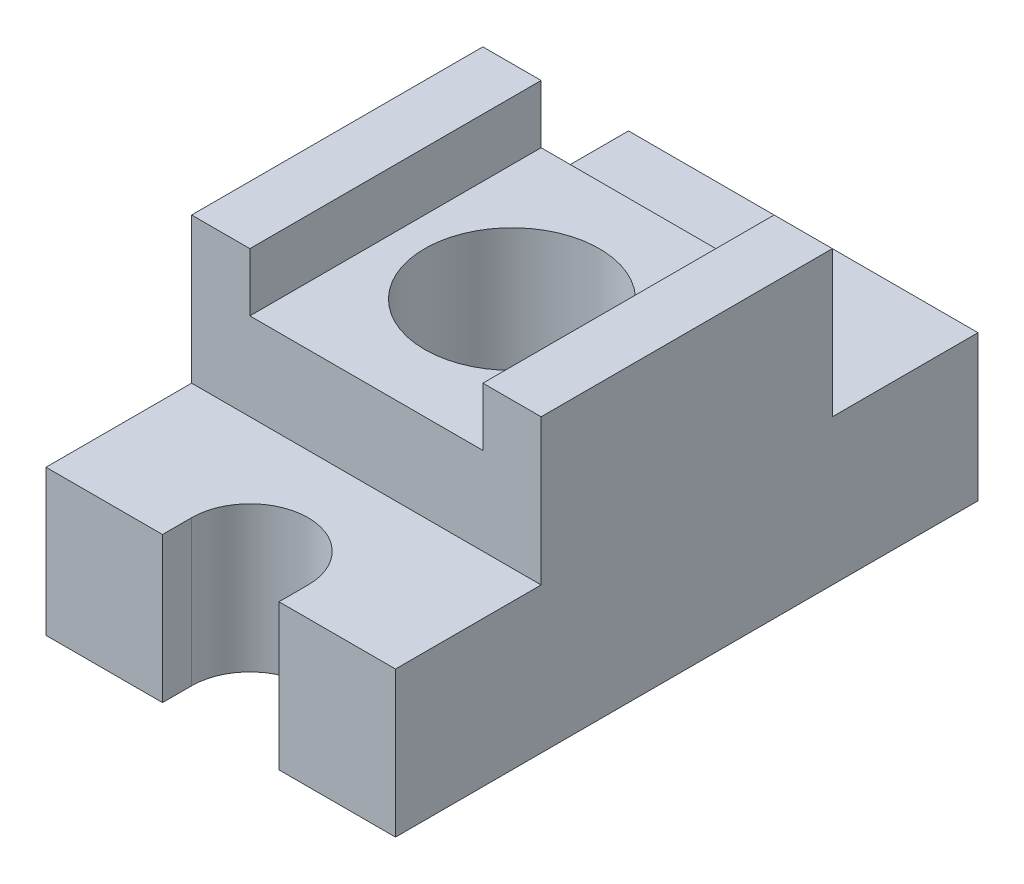
from build123d import *

# Parameters (mm, degrees)
BOSS_EXTRU_1_DEPTH      = 60
ENL_V_MAT_EXTRU_1_DEPTH = 83.006097334
ESQUISSE3_W             = 40
ESQUISSE3_H             = 50
ENL_V_MAT_EXTRU_2_DEPTH = 10
ESQUISSE4_R             = 15
ENL_V_MAT_EXTRU_3_DEPTH = 88.749643874


with BuildPart() as part:
    # Esquisse1 → Boss.-Extru.1 (new body)
    with BuildSketch(Plane(origin=(0, 0, 0), x_dir=(0, 0, -1), z_dir=(1, 0, 0))):
        Polygon((-50, 0), (-25, 0), (-25, 25), (25, 25), (25, 0), (50, 0), (50, -25), (-50, -25), align=None)
    extrude(amount=BOSS_EXTRU_1_DEPTH)

    # Esquisse2 → Enlèv. mat.-Extru.1 (cut, through all)
    with BuildSketch(Plane(origin=(0, 0, 0), x_dir=(1, 0, 0), z_dir=(0, 1, 0))):
        with BuildLine():
            Line((40, -45), (40, -60))
            ThreePointArc((40, -60), (30, -70), (20, -60))
            Line((20, -60), (20, -45))
            ThreePointArc((20, -45), (30, -35), (40, -45))
        make_face()
    extrude(amount=-ENL_V_MAT_EXTRU_1_DEPTH, mode=Mode.SUBTRACT)

    # Esquisse3 → Enlèv. mat.-Extru.2 (cut)
    with BuildSketch(Plane(origin=(0, 25, 0), x_dir=(1, 0, 0), z_dir=(0, 1, 0))):
        with Locations((30, 0)):
            Rectangle(ESQUISSE3_W, ESQUISSE3_H)
    extrude(amount=-ENL_V_MAT_EXTRU_2_DEPTH, mode=Mode.SUBTRACT)

    # Esquisse4 → Enlèv. mat.-Extru.3 (cut, through all)
    with BuildSketch(Plane(origin=(0, 15, 0), x_dir=(1, 0, 0), z_dir=(0, 1, 0))):
        with Locations(Location((30, 0, 0), (0, 0, 270))):
            Circle(ESQUISSE4_R)
    extrude(amount=-ENL_V_MAT_EXTRU_3_DEPTH, mode=Mode.SUBTRACT)


solid = part.part
